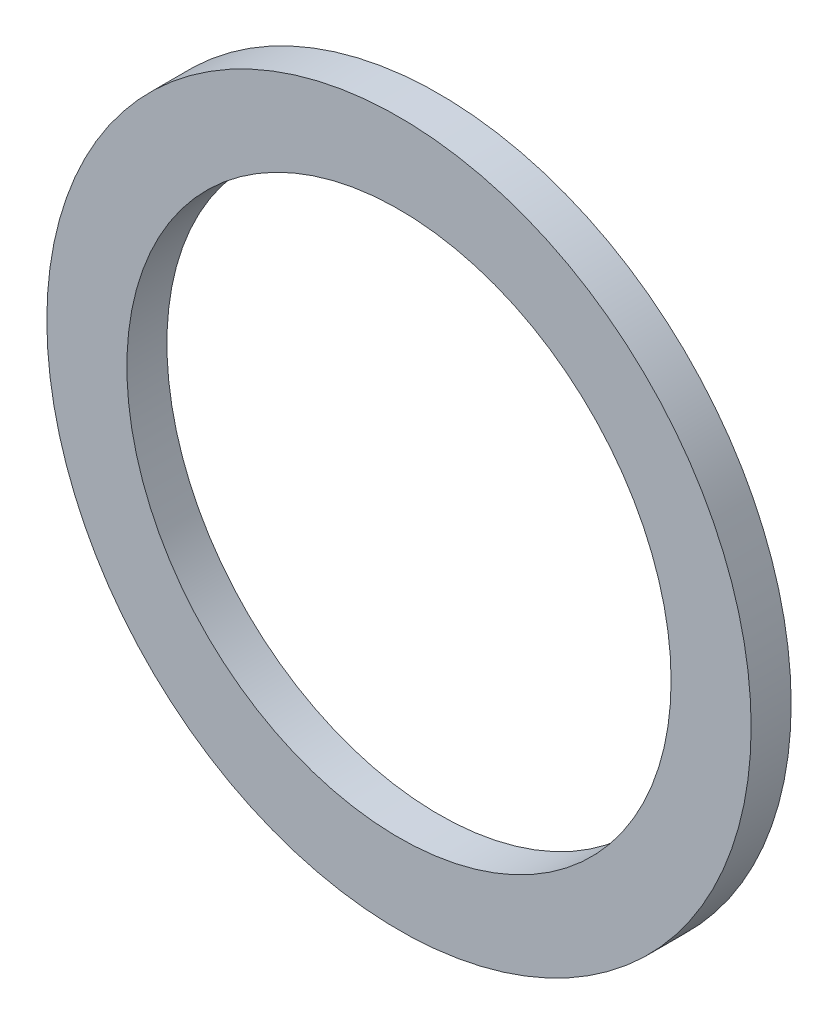
from build123d import *

# Parameters (mm, degrees)
SKETCH1_R           = 111.76
SKETCH1_R_2         = 86.36
BOSS_EXTRUDE1_DEPTH = 12.7


with BuildPart() as part:
    # Sketch1 → Boss-Extrude1 (new body)
    with BuildSketch(Plane.XY):
        Circle(SKETCH1_R)
        Circle(SKETCH1_R_2, mode=Mode.SUBTRACT)
    extrude(amount=BOSS_EXTRUDE1_DEPTH)


solid = part.part
